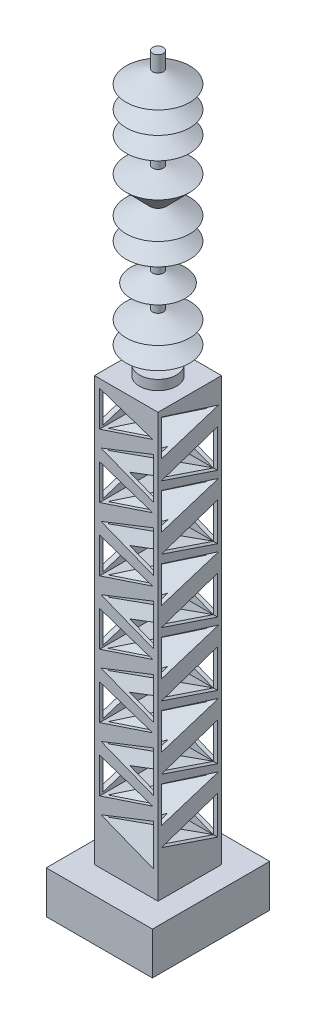
from build123d import *

# Parameters (mm, degrees)
CROQUIS1_W              = 300
CROQUIS1_H              = 300
SALIENTE_EXTRUIR1_DEPTH = 2000
CORTAR_EXTRUIR1_DEPTH   = 2000
CORTAR_EXTRUIR2_DEPTH   = 2000
MATRIZL1_COUNT          = 6
MATRIZL1_PITCH          = 300
CORTAR_EXTRUIR3_DEPTH   = 2000
CORTAR_EXTRUIR4_DEPTH   = 2000
MATRIZL2_COUNT          = 6
MATRIZL2_PITCH          = 300
CROQUIS7_W              = 501.40083012
CROQUIS7_H              = 554.08918551
SALIENTE_EXTRUIR2_DEPTH = 200


with BuildPart() as part:
    # Croquis1 → Saliente-Extruir1 (new body)
    with BuildSketch(Plane(origin=(0, 0, 0), x_dir=(1, 0, 0), z_dir=(0, 1, 0))):
        Rectangle(CROQUIS1_W, CROQUIS1_H)
    extrude(amount=SALIENTE_EXTRUIR1_DEPTH)

    # Croquis2 → Cortar-Extruir1 (cut)
    with BuildSketch(Plane(origin=(150, 0, 0), x_dir=(0, 0, -1), z_dir=(1, 0, 0))):
        Polygon((-134.088234314, 1972.180540506), (-134.088234314, 1800.957617314), (135.917144565, 1886.56907891), align=None)
    cortar_extruir1 = extrude(amount=-CORTAR_EXTRUIR1_DEPTH, mode=Mode.SUBTRACT)

    # Croquis3 → Cortar-Extruir2 (cut)
    with BuildSketch(Plane(origin=(150, 0, 0), x_dir=(0, 0, -1), z_dir=(1, 0, 0))):
        Polygon((131.605393235, 1800.957617314), (131.605393235, 1621.526206022), (-134.088234314, 1711.241911668), align=None)
    cortar_extruir2 = extrude(amount=-CORTAR_EXTRUIR2_DEPTH, mode=Mode.SUBTRACT)

    # MatrizL1: Cortar-Extruir1, Cortar-Extruir2 ×6
    with Locations(*[(0, -i * MATRIZL1_PITCH, 0) for i in range(1, MATRIZL1_COUNT)]):
        add(cortar_extruir1, mode=Mode.SUBTRACT)
        add(cortar_extruir2, mode=Mode.SUBTRACT)

    # Croquis4 → Cortar-Extruir3 (cut)
    with BuildSketch(Plane.XY.offset(150)):
        Polygon((-125.686309313, 1959.930435597), (-125.686309313, 1792.928200212), (124.817043765, 1876.429317904), align=None)
    cortar_extruir3 = extrude(amount=-CORTAR_EXTRUIR3_DEPTH, mode=Mode.SUBTRACT)

    # Croquis5 → Cortar-Extruir4 (cut)
    with BuildSketch(Plane.XY.offset(150)):
        Polygon((129.926140532, 1817.086818278), (129.926140532, 1621.163523369), (-118.978051934, 1719.157299931), align=None)
    cortar_extruir4 = extrude(amount=-CORTAR_EXTRUIR4_DEPTH, mode=Mode.SUBTRACT)

    # MatrizL2: Cortar-Extruir3, Cortar-Extruir4 ×6
    with Locations(*[(0, -i * MATRIZL2_PITCH, 0) for i in range(1, MATRIZL2_COUNT)]):
        add(cortar_extruir3, mode=Mode.SUBTRACT)
        add(cortar_extruir4, mode=Mode.SUBTRACT)

    # Croquis6 → Revolución1 (revolve)
    with BuildSketch(Plane.XY):
        Polygon((0, 2000), (0, 3329.965614327), (25.332654562, 3329.965614327), (25.332654562, 3298.73521578), (25.332654562, 3255.281255936), (150, 3192.145208398), (25.332654562, 3151.299601463), (150, 3088.163553925), (25.332654562, 3047.31794699), (150, 2984.181899452), (25.332654562, 2943.336292517), (25.332654562, 2860.872667469), (150, 2824.128451403), (38.444285562, 2710.7965044), (150, 2654.300660478), (25.332654562, 2613.455053543), (150, 2550.319006005), (25.332654562, 2491.04511238), (25.332654562, 2431.527269427), (128.122090951, 2379.470985405), (25.332654562, 2320.316255375), (25.332654562, 2272.46184806), (150, 2228.839509408), (25.332654562, 2169.565615782), (150, 2125.94327713), (25.332654562, 2066.669383504), (25.332654562, 2046.290702054), (67.666327281, 2046.290702054), (87.666327281, 2046.290702054), (87.666327281, 2026.290702054), (87.666327281, 2000), align=None)
    revolve(axis=Axis((0, 2000, 0), (0, 1, 0)))

    # Croquis7 → Saliente-Extruir2 (add)
    with BuildSketch(Plane.XZ):
        Rectangle(CROQUIS7_W, CROQUIS7_H)
    extrude(amount=SALIENTE_EXTRUIR2_DEPTH)


solid = part.part
